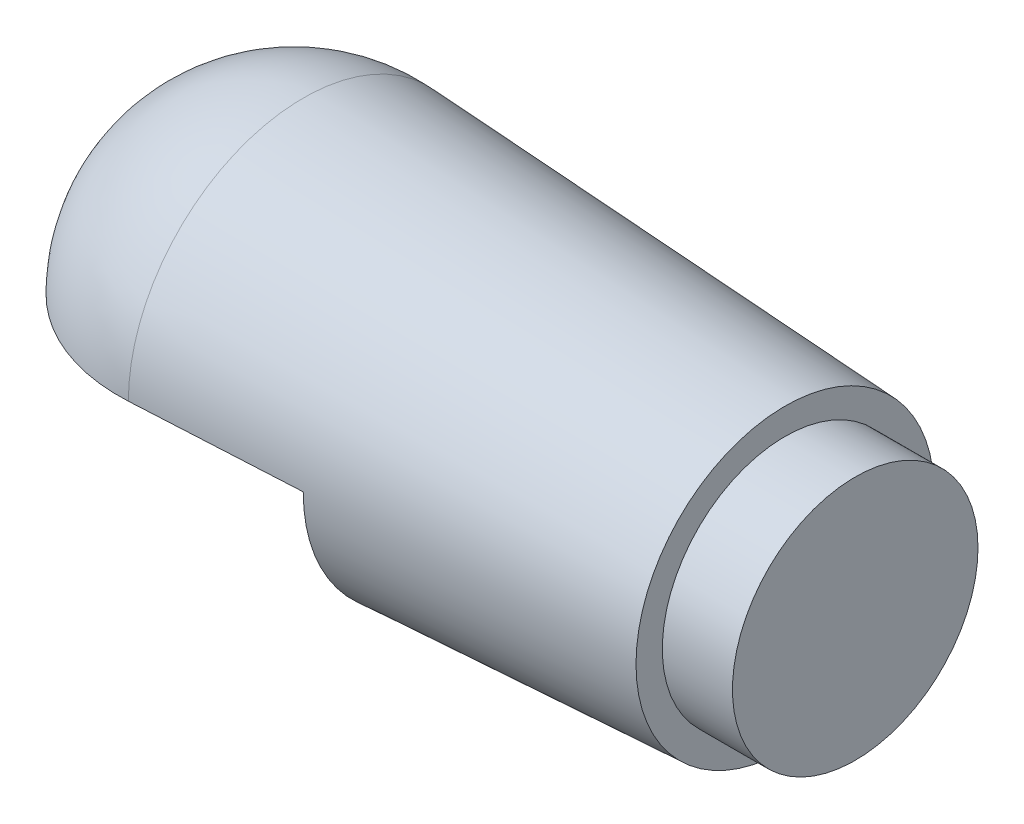
from build123d import *

# Parameters (mm, degrees)
SKETCH2_W           = 100
SKETCH2_H           = 100
CUT_EXTRUDE1_DEPTH  = 62
SKETCH3_R           = 35
BOSS_EXTRUDE1_DEPTH = 20


with BuildPart() as part:
    # Sketch1 → Revolve1 (revolve)
    with BuildSketch(Plane(origin=(0, 0, 0), x_dir=(1, 0, 0), z_dir=(0, 1, 0)), mode=Mode.PRIVATE) as revolve1_sk:
        with BuildLine():
            Line((0, 0), (0, 42.5))
            Line((0, 42.5), (-137.299270073, 49.927007299))
            ThreePointArc((-137.299270073, 49.927007299), (-174.387232396, 36.297634195), (-190, 0))
            Line((-190, 0), (-175, 0))
            ThreePointArc((-175, 0), (-140, 35), (-105, 0))
            Line((-105, 0), (0, 0))
        make_face()
    revolve(revolve1_sk.sketch.rotate(Axis((-105, 0, 0), (1, 0, 0)), 180), axis=Axis((-105, 0, 0), (1, 0, 0)))

    # Sketch2 → Cut-Extrude1 (cut)
    with BuildSketch(Plane(origin=(0, 0, 0), x_dir=(1, 0, 0), z_dir=(0, 1, 0))):
        with Locations((-140, 0)):
            Rectangle(SKETCH2_W, SKETCH2_H)
    extrude(amount=-CUT_EXTRUDE1_DEPTH, mode=Mode.SUBTRACT)

    # Sketch3 → Boss-Extrude1 (add)
    with BuildSketch(Plane(origin=(0, 0, 0), x_dir=(0, 0, -1), z_dir=(1, 0, 0))):
        Circle(SKETCH3_R)
    extrude(amount=BOSS_EXTRUDE1_DEPTH)


solid = part.part
